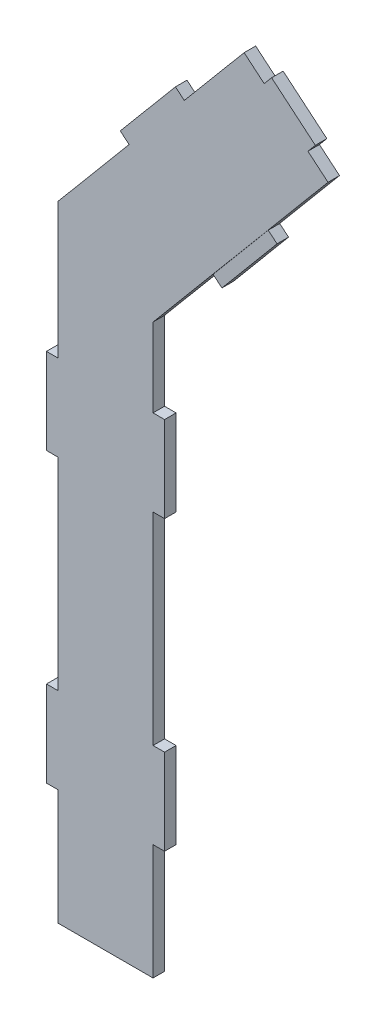
from build123d import *

# Parameters (mm, degrees)
SKETCH1_W           = 2
SKETCH1_H           = 14.9
BOSS_EXTRUDE2_DEPTH = 2


with BuildPart() as part:
    # Sketch1 → Boss-Extrude2 (new body)
    with BuildSketch(Plane.XY):
        Polygon((43.384701574, 137.728482154), (46.871714558, 134.805599937), (16.5, 98.61), (16.5, 0), (0, 0), (0, 20.05), (-2, 20.05), (-2, 34.95), (0, 34.95), (0, 70.05), (-2, 70.05), (-2, 84.95), (0, 84.95), (0, 108.5), (12.344617782, 123.211742591), (10.812528896, 124.497317811), (20.39006428, 135.911380013), (21.922153167, 134.625804794), (32.312933139, 147.009054156), (35.797574423, 144.088159944), (37.082357815, 145.620912904), (44.669484966, 139.261235114), align=None)
        with Locations((17.5, 77.5)):
            Rectangle(SKETCH1_W, SKETCH1_H)
        with Locations((17.5, 27.5)):
            Rectangle(SKETCH1_W, SKETCH1_H)
        Polygon((36.491365695, 122.413607016), (38.024782319, 121.129615795), (28.45904772, 109.705661945), (26.925631095, 110.989653166), align=None)
    extrude(amount=BOSS_EXTRUDE2_DEPTH)


solid = part.part
